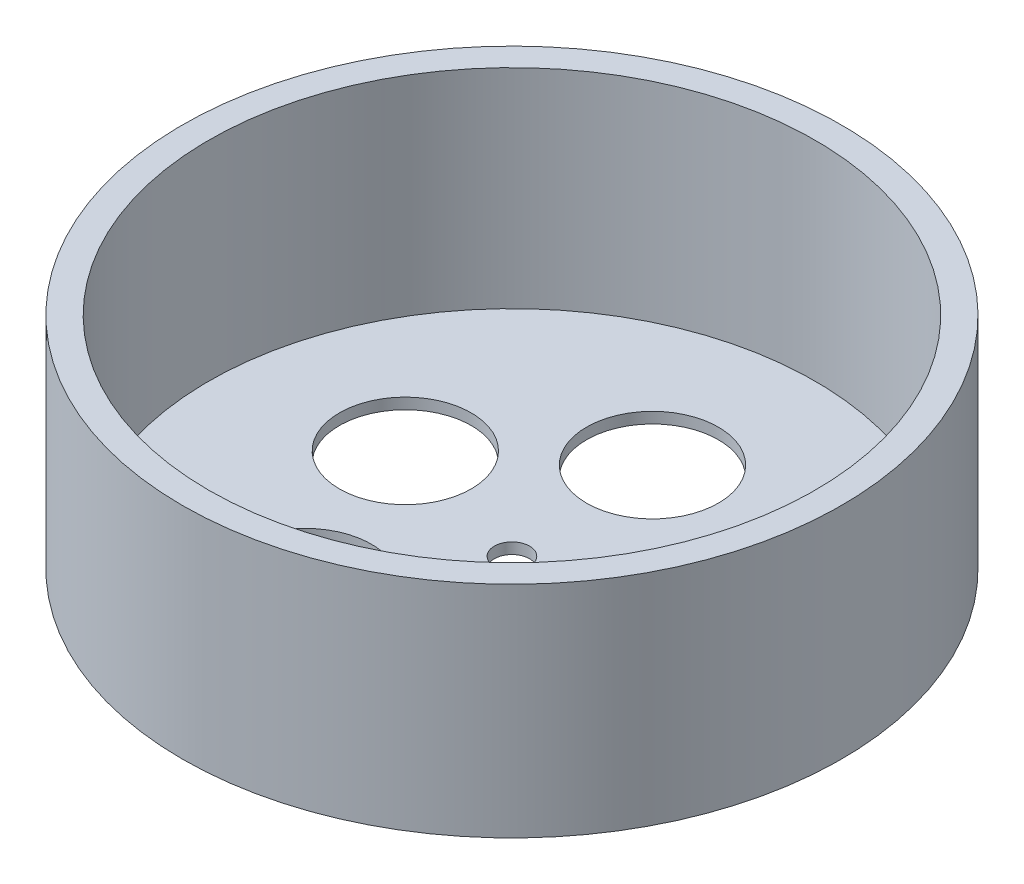
from build123d import *

# Parameters (mm, degrees)
SKETCH1_R           = 150
BOSS_EXTRUDE1_DEPTH = 100
SKETCH3_R           = 138
CUT_EXTRUDE1_DEPTH  = 95
SKETCH4_R           = 30
CUT_EXTRUDE2_DEPTH  = 8
SKETCH5_R           = 8
CUT_EXTRUDE3_DEPTH  = 8
SCALE1_SCALE        = 0.01


with BuildPart() as part:
    # Sketch1 → Boss-Extrude1 (new body)
    with BuildSketch(Plane(origin=(0, 0, 0), x_dir=(1, 0, 0), z_dir=(0, 1, 0))):
        with Locations(Location((0, 0, 0), (0, 0, 270))):
            Circle(SKETCH1_R)
    extrude(amount=BOSS_EXTRUDE1_DEPTH)

    # Sketch3 → Cut-Extrude1 (cut)
    with BuildSketch(Plane(origin=(0, 100, 0), x_dir=(1, 0, 0), z_dir=(0, 1, 0))):
        with Locations(Location((0, 0, 0), (0, 0, 270))):
            Circle(SKETCH3_R)
    extrude(amount=-CUT_EXTRUDE1_DEPTH, mode=Mode.SUBTRACT)

    # Sketch4 → Cut-Extrude2 (cut)
    with BuildSketch(Plane(origin=(0, 5, 0), x_dir=(1, 0, 0), z_dir=(0, 1, 0))):
        with Locations(Location((-3.91997957, 67.886918918, 0), (0, 0, 270))):
            Circle(SKETCH4_R)
        with Locations(Location((63.352956303, 24.706333755, 0), (0, 0, 270))):
            Circle(SKETCH4_R)
        with Locations(Location((43.074259853, -52.61756492, 0), (0, 0, 270))):
            Circle(SKETCH4_R)
        with Locations(Location((-36.731599674, -57.225777281, 0), (0, 0, 270))):
            Circle(SKETCH4_R)
        with Locations(Location((-65.775636913, 17.250089528, 0), (0, 0, 270))):
            Circle(SKETCH4_R)
    extrude(amount=-CUT_EXTRUDE2_DEPTH, mode=Mode.SUBTRACT)

    # Sketch5 → Cut-Extrude3 (cut)
    with BuildSketch(Plane(origin=(0, 5, 0), x_dir=(1, 0, 0), z_dir=(0, 1, 0))):
        with Locations(Location((0, 0, 0), (0, 0, 270))):
            Circle(SKETCH5_R)
    extrude(amount=-CUT_EXTRUDE3_DEPTH, mode=Mode.SUBTRACT)


with BuildPart() as part_1:
    # Scale1: scaled about (0, 0, 0)
    add(part.part.scale(SCALE1_SCALE))


solid = part_1.part
